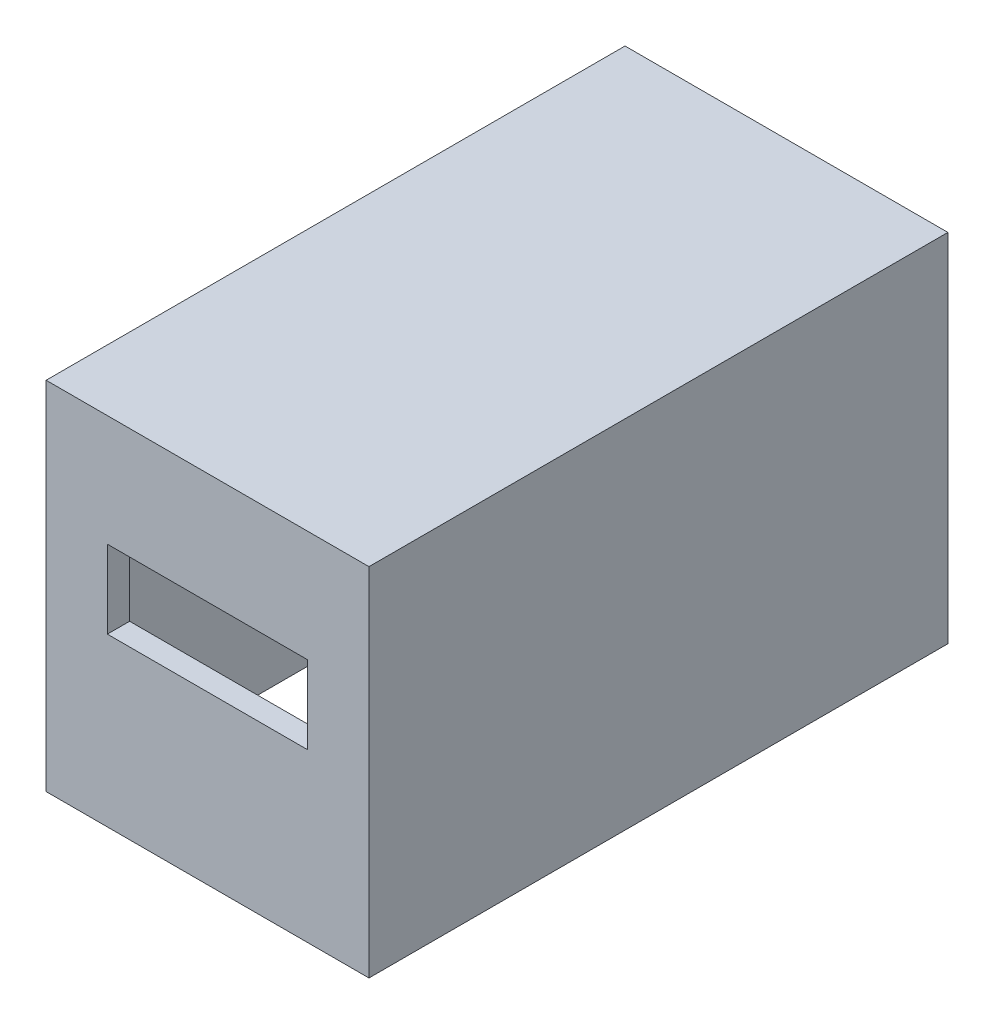
from build123d import *

# Parameters (mm, degrees)
IZIM1_W                     = 14.5
IZIM1_H                     = 26
IZIM1_W_2                   = 12.5
IZIM1_H_2                   = 24
Y_KSEKLIK_EKSTR_ZYON1_DEPTH = 15
IZIM2_W                     = 14.5
IZIM2_H                     = 26
Y_KSEKLIK_EKSTR_ZYON2_DEPTH = 1
KES_EKSTR_ZYON1_DEPTH       = 2


with BuildPart() as part:
    # Çizim1 → Yükseklik-Ekstrüzyon1 (new body)
    with BuildSketch(Plane(origin=(0, 0, 0), x_dir=(1, 0, 0), z_dir=(0, 1, 0))):
        Rectangle(IZIM1_W, IZIM1_H)
        Rectangle(IZIM1_W_2, IZIM1_H_2, mode=Mode.SUBTRACT)
    extrude(amount=Y_KSEKLIK_EKSTR_ZYON1_DEPTH)

    # Çizim2 → Yükseklik-Ekstrüzyon2 (add)
    with BuildSketch(Plane(origin=(0, 15, 0), x_dir=(1, 0, 0), z_dir=(0, 1, 0))):
        Rectangle(IZIM2_W, IZIM2_H)
    extrude(amount=Y_KSEKLIK_EKSTR_ZYON2_DEPTH)

    # Çizim3 → Kes-Ekstrüzyon1 (cut)
    with BuildSketch(Plane.XY.offset(13)):
        Polygon((4.5, 11), (0, 11), (-4.5, 11), (-4.5, 7.5), (4.5, 7.5), align=None)
    extrude(amount=-KES_EKSTR_ZYON1_DEPTH, mode=Mode.SUBTRACT)


solid = part.part
